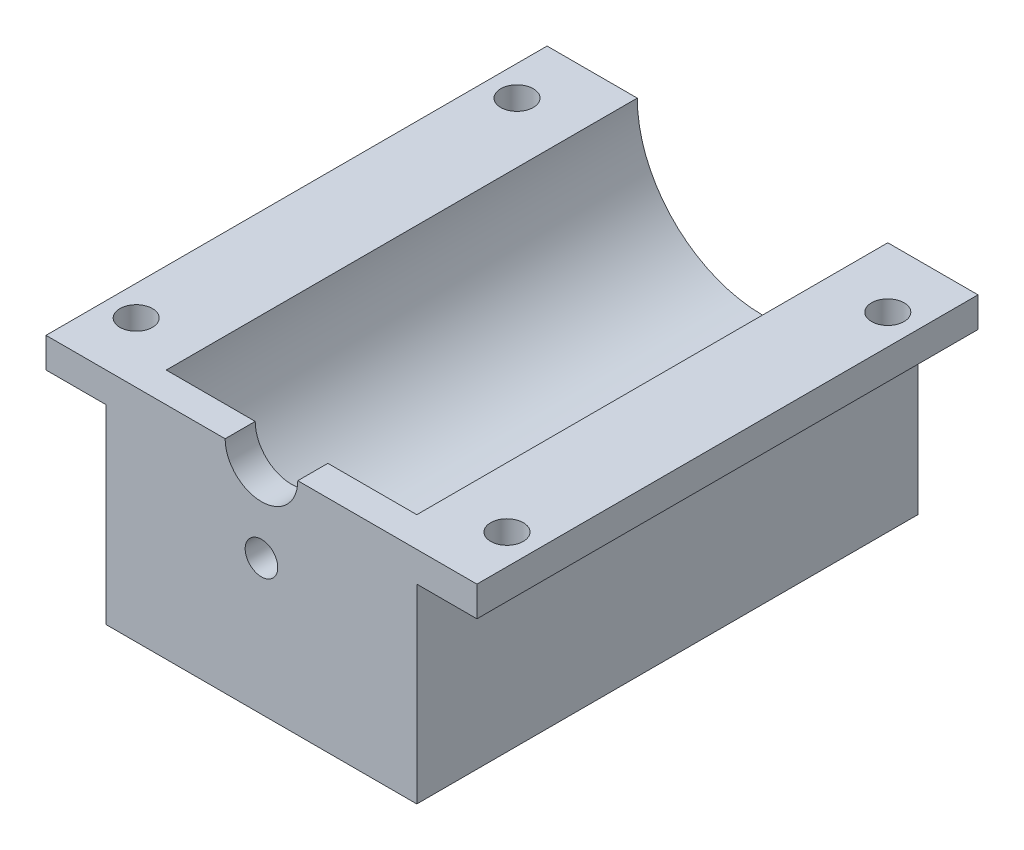
from build123d import *

# Parameters (mm, degrees)
BOSS_EXTRU_1_DEPTH      = 50
ESQUISSE4_R             = 1.625
ENL_V_MAT_EXTRU_1_DEPTH = 50
ESQUISSE7_R             = 1.625
BOSS_EXTRU_2_DEPTH      = 3


with BuildPart() as part:
    # Esquisse1 → Boss.-Extru.1 (new body)
    with BuildSketch(Plane.XY):
        with BuildLine():
            Line((-6, 19), (-6, 22))
            Line((-6, 22), (3, 22))
            ThreePointArc((3, 22), (15.5, 9.5), (28, 22))
            Line((28, 22), (37, 22))
            Line((37, 22), (37, 19))
            Line((37, 19), (31, 19))
            Line((31, 19), (31, 0))
            Line((31, 0), (0, 0))
            Line((0, 0), (0, 19))
            Line((0, 19), (-6, 19))
        make_face()
    extrude(amount=BOSS_EXTRU_1_DEPTH)

    # Esquisse4 → Enlèv. mat.-Extru.1 (cut)
    with BuildSketch(Plane(origin=(0, 22, 0), x_dir=(1, 0, 0), z_dir=(0, 1, 0))):
        with Locations(Location((-3, -44, 0), (0, 0, 270))):
            Circle(ESQUISSE4_R)
        with Locations(Location((34, -44, 0), (0, 0, 270))):
            Circle(ESQUISSE4_R)
        with Locations(Location((34, -6, 0), (0, 0, 270))):
            Circle(ESQUISSE4_R)
        with Locations(Location((-3, -6, 0), (0, 0, 270))):
            Circle(ESQUISSE4_R)
    extrude(amount=-ENL_V_MAT_EXTRU_1_DEPTH, mode=Mode.SUBTRACT)

    # Esquisse7 → Boss.-Extru.2 (add)
    with BuildSketch(Plane.XY.offset(50)):
        with BuildLine():
            Line((19.125, 22), (28, 22))
            Line((28, 22), (28, 9.5))
            Line((28, 9.5), (3, 9.5))
            Line((3, 9.5), (3, 22))
            Line((3, 22), (11.875, 22))
            ThreePointArc((11.875, 22), (15.5, 18.375), (19.125, 22))
        make_face()
        with Locations((15.5, 13.5)):
            Circle(ESQUISSE7_R, mode=Mode.SUBTRACT)
    extrude(amount=-BOSS_EXTRU_2_DEPTH)


solid = part.part
